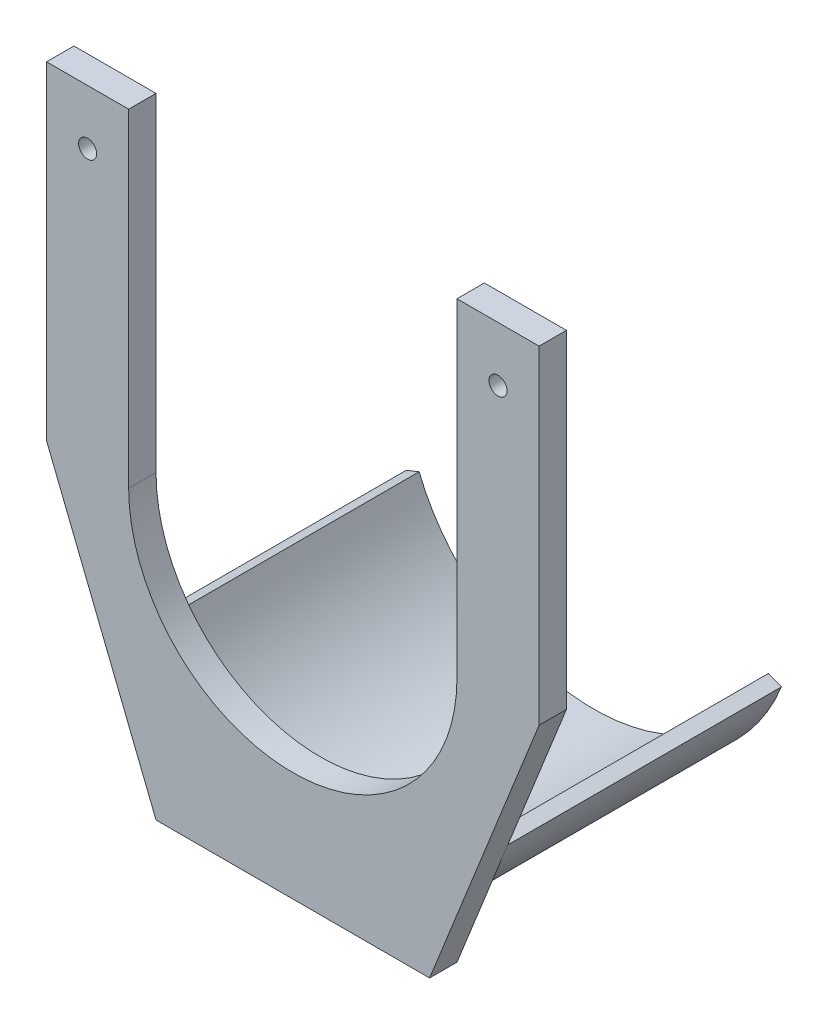
from build123d import *

# Parameters (mm, degrees)
SKETCH_1_R      = 1.65
EXTRUDE_1_DEPTH = 5
EXTRUDE_2_DEPTH = 50


with BuildPart() as part:
    # 스케치1 → 보스-돌출1 (new body)
    with BuildSketch(Plane.XY):
        with BuildLine():
            Line((-25, -50), (25, -50))
            Line((25, -50), (45, 0))
            Line((45, 0), (45, 60))
            Line((45, 60), (30, 60))
            Line((30, 60), (30, 0))
            ThreePointArc((30, 0), (0, -30), (-30, 0))
            Line((-30, 0), (-30, 60))
            Line((-30, 60), (-45, 60))
            Line((-45, 60), (-45, 0))
            Line((-45, 0), (-25, -50))
        make_face()
        with Locations((-37.5, 50)):
            Circle(SKETCH_1_R, mode=Mode.SUBTRACT)
        with Locations(Location((37.5, 50, 0), (0, 0, 180))):
            Circle(SKETCH_1_R, mode=Mode.SUBTRACT)
    extrude(amount=EXTRUDE_1_DEPTH)

    # 스케치4 → 보스-돌출2 (add)
    with BuildSketch(Plane(origin=(0, 0, 0), x_dir=(-1, 0, 0), z_dir=(0, 0, -1))):
        with BuildLine():
            Line((-31.916553531, -25.840797377), (-34.284766909, -26.788082728))
            ThreePointArc((-34.284766909, -26.788082728), (0, -50), (34.284766909, -26.788082728))
            Line((34.284766909, -26.788082728), (31.916553531, -25.840797377))
            ThreePointArc((31.916553531, -25.840797377), (0, -47.449356133), (-31.916553531, -25.840797377))
        make_face()
    extrude(amount=EXTRUDE_2_DEPTH)


solid = part.part
